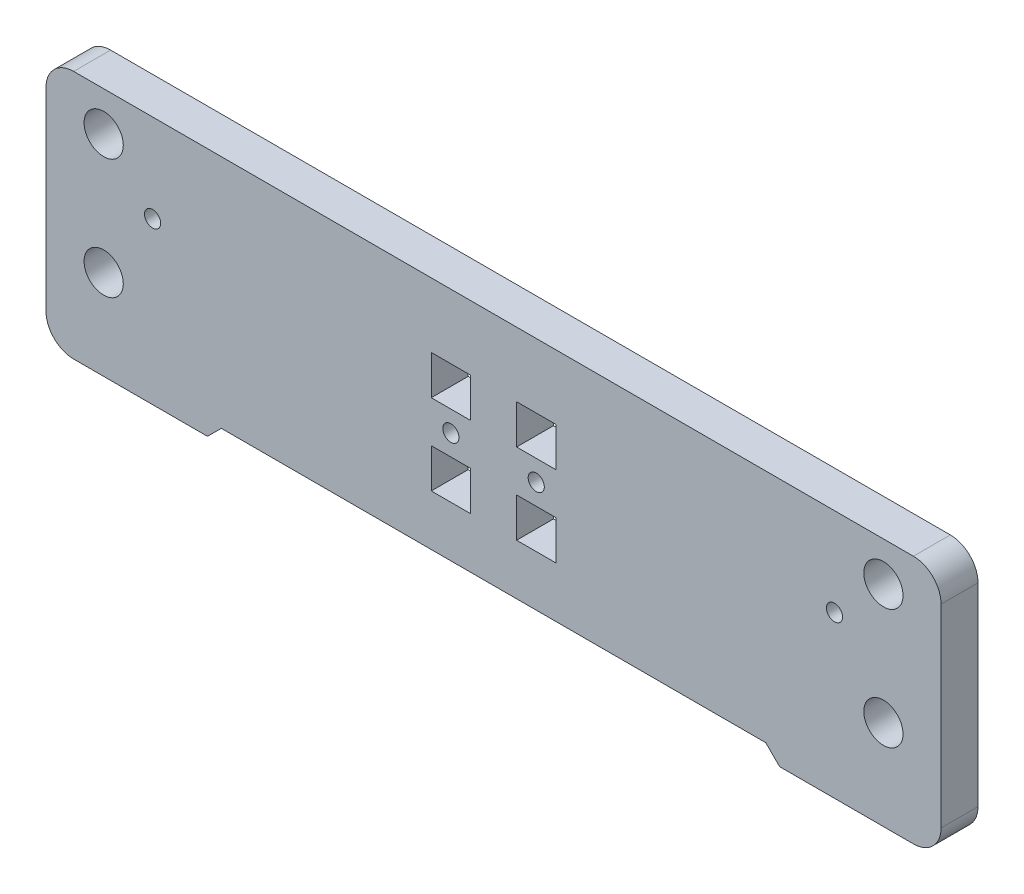
from build123d import *

# Parameters (mm, degrees)
SKETCH1_R      = 4.25
SKETCH1_R_2    = 1.75
SKETCH1_W      = 8.5
SKETCH1_H      = 8.5
EXTRUDE1_DEPTH = 8
SKETCH2_R      = 1.75
EXTRUDE2_DEPTH = 10


with BuildPart() as part:
    # Sketch1 → Extrude1 (new body)
    with BuildSketch(Plane.XY):
        with BuildLine():
            Line((5.082943524, 52.898094917), (5.082943524, 10.898094917))
            ThreePointArc((5.082943524, 10.898094917), (6.840302837, 6.65545423), (11.082943524, 4.898094917))
            Line((11.082943524, 4.898094917), (40.082943524, 4.898094917))
            Line((40.082943524, 4.898094917), (43.082943524, 7.898094917))
            Line((43.082943524, 7.898094917), (161.082943524, 7.898094917))
            Line((161.082943524, 7.898094917), (164.082943524, 4.898094917))
            Line((164.082943524, 4.898094917), (193.082943524, 4.898094917))
            ThreePointArc((193.082943524, 4.898094917), (197.325584211, 6.65545423), (199.082943524, 10.898094917))
            Line((199.082943524, 10.898094917), (199.082943524, 52.898094917))
            ThreePointArc((199.082943524, 52.898094917), (197.325584211, 57.140735604), (193.082943524, 58.898094917))
            Line((193.082943524, 58.898094917), (11.082943524, 58.898094917))
            ThreePointArc((11.082943524, 58.898094917), (6.840302837, 57.140735604), (5.082943524, 52.898094917))
        make_face()
        with Locations((186.582943524, 50.398094917)):
            Circle(SKETCH1_R, mode=Mode.SUBTRACT)
        with Locations((186.582943524, 24.398094917)):
            Circle(SKETCH1_R, mode=Mode.SUBTRACT)
        with Locations((17.582943524, 50.398094917)):
            Circle(SKETCH1_R, mode=Mode.SUBTRACT)
        with Locations((17.582943524, 24.398094917)):
            Circle(SKETCH1_R, mode=Mode.SUBTRACT)
        with Locations((92.832943524, 31.898094917)):
            Circle(SKETCH1_R_2, mode=Mode.SUBTRACT)
        with Locations((111.332943524, 31.898094917)):
            Circle(SKETCH1_R_2, mode=Mode.SUBTRACT)
        with Locations((92.832943524, 40.648094917)):
            Rectangle(SKETCH1_W, SKETCH1_H, mode=Mode.SUBTRACT)
        with Locations((111.332943524, 40.648094917)):
            Rectangle(SKETCH1_W, SKETCH1_H, mode=Mode.SUBTRACT)
        with Locations((92.832943524, 23.148094917)):
            Rectangle(SKETCH1_W, SKETCH1_H, mode=Mode.SUBTRACT)
        with Locations((111.332943524, 23.148094917)):
            Rectangle(SKETCH1_W, SKETCH1_H, mode=Mode.SUBTRACT)
    extrude(amount=EXTRUDE1_DEPTH)

    # Sketch2 → Extrude2 (cut)
    with BuildSketch(Plane.XY.offset(8)):
        with Locations((28.189545242, 39.791493199)):
            Circle(SKETCH2_R)
        with Locations((175.976341806, 39.791493199)):
            Circle(SKETCH2_R)
    extrude(amount=-EXTRUDE2_DEPTH, mode=Mode.SUBTRACT)


solid = part.part
